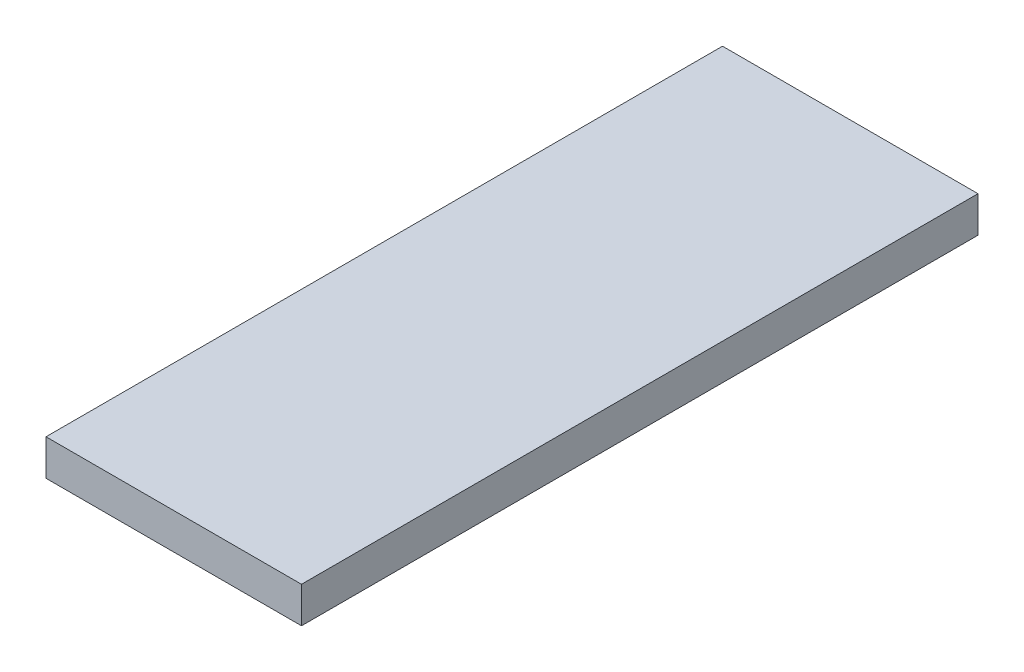
from build123d import *

# Parameters (mm, degrees)
SKETCH1_W           = 355
SKETCH1_H           = 50
BOSS_EXTRUDE1_DEPTH = 940


with BuildPart() as part:
    # Sketch1 → Boss-Extrude1 (new body)
    with BuildSketch(Plane.XY):
        with Locations((177.5, 25)):
            Rectangle(SKETCH1_W, SKETCH1_H)
    extrude(amount=BOSS_EXTRUDE1_DEPTH)


solid = part.part
